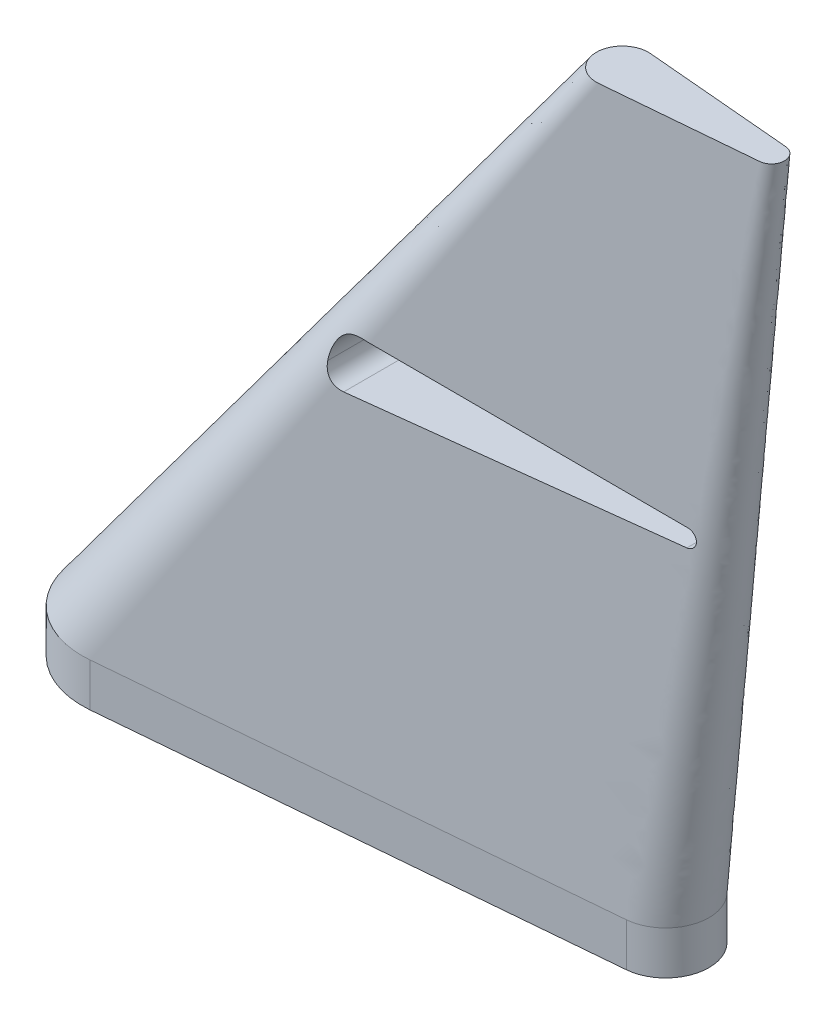
from build123d import *

# Parameters (mm, degrees)
BOSS_EXTRUDE1_DEPTH     = 1.27
CUT_EXTRUDE1_DEPTH      = 30.042571975
CUT_EXTRUDE1_DEPTH_BACK = 30.042571975


with BuildPart() as part:
    # Sketch1 → Boss-Extrude1 (new body)
    with BuildSketch(Plane(origin=(0, 0, 0), x_dir=(1, 0, 0), z_dir=(0, 1, 0))):
        with BuildLine():
            Line((2.761375587, 2.530334533), (17.222303615, 1.265167267))
            ThreePointArc((17.222303615, 1.265167267), (18.381615822, 0), (17.222303615, -1.265167267))
            Line((17.222303615, -1.265167267), (2.761375587, -2.530334533))
            ThreePointArc((2.761375587, -2.530334533), (0, 0), (2.761375587, 2.530334533))
        make_face()
    extrude(amount=-BOSS_EXTRUDE1_DEPTH)

    # Sketch1<3> → Loft2 section 0
    with BuildSketch(Plane(origin=(0, 0, 0), x_dir=(1, 0, 0), z_dir=(0, 1, 0))):
        with BuildLine():
            Line((2.761375587, 2.530334533), (17.222303615, 1.265167267))
            ThreePointArc((17.222303615, 1.265167267), (18.381615822, 0), (17.222303615, -1.265167267))
            Line((17.222303615, -1.265167267), (2.761375587, -2.530334533))
            ThreePointArc((2.761375587, -2.530334533), (0, 0), (2.761375587, 2.530334533))
        make_face()
    # Sketch5 → Loft2 section 1
    with BuildSketch(Plane(origin=(0, 20.32, 0), x_dir=(1, 0, 0), z_dir=(0, 1, 0))):
        with BuildLine():
            Line((15.908028498, 0.75910036), (20.246306907, 0.37955018))
            ThreePointArc((20.246306907, 0.37955018), (20.594100569, 0), (20.246306907, -0.37955018))
            Line((20.246306907, -0.37955018), (15.908028498, -0.75910036))
            ThreePointArc((15.908028498, -0.75910036), (15.079615822, 0), (15.908028498, 0.75910036))
        make_face()
    loft()

    # Sketch7 → Cut-Extrude1 (cut, two sides: drawn at the far end of the back side and taken through both)
    with BuildSketch(Plane.XY.offset(-CUT_EXTRUDE1_DEPTH_BACK)):
        with BuildLine():
            Line((9.913963672, 11.172133813), (18.59052049, 10.413033453))
            ThreePointArc((18.59052049, 10.413033453), (18.822269376, 10.152405715), (18.575356903, 9.906095759))
            Line((18.575356903, 9.906095759), (9.331361381, 9.652191518))
            ThreePointArc((9.331361381, 9.652191518), (8.963168858, 9.795891805), (8.809413438, 10.16))
            ThreePointArc((8.809413438, 10.16), (9.139013787, 10.909073774), (9.913963672, 11.172133813))
        make_face()
    extrude(amount=CUT_EXTRUDE1_DEPTH + CUT_EXTRUDE1_DEPTH_BACK, mode=Mode.SUBTRACT)


solid = part.part
